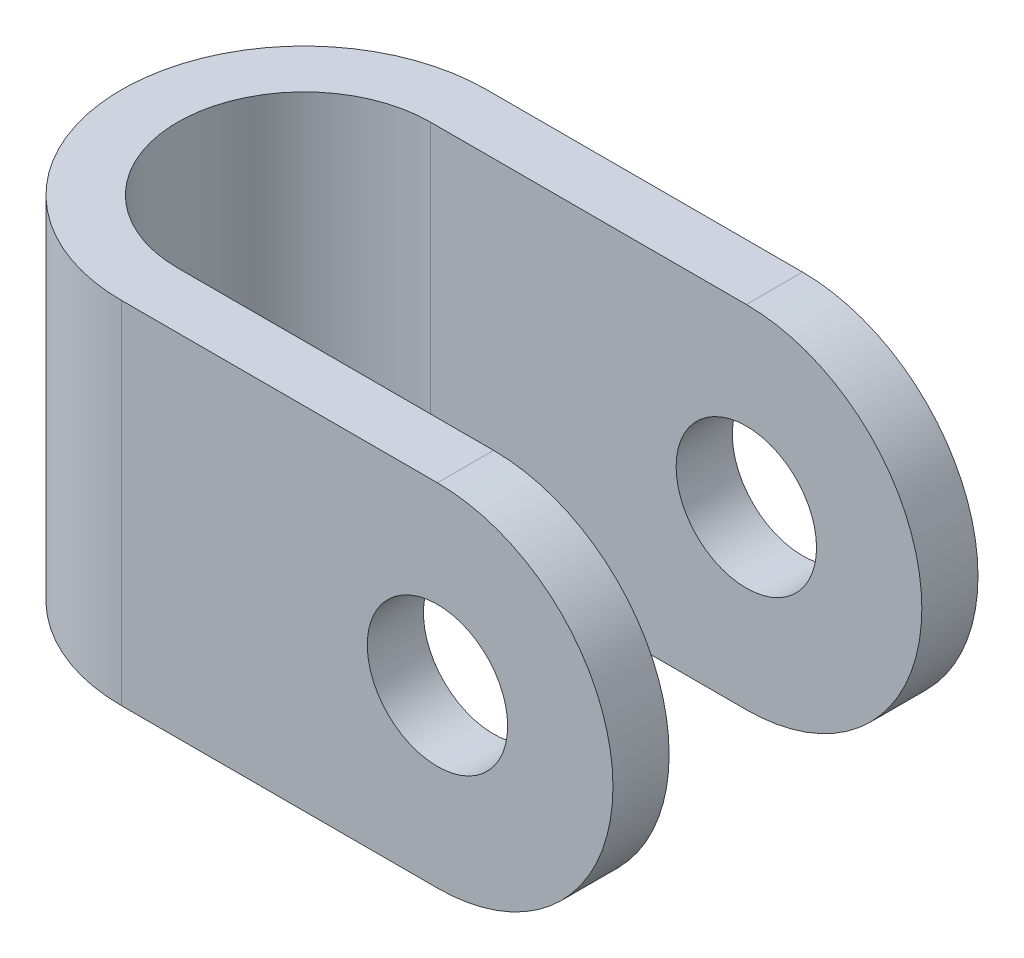
from build123d import *

# Parameters (mm, degrees)
BOSS_EXTRUDE1_DEPTH = 12.5
CUT_EXTRUDE1_DEPTH  = 46.356917885


with BuildPart() as part:
    # Sketch1 → Boss-Extrude1 (new, symmetric)
    with BuildSketch(Plane(origin=(0, 0, 0), x_dir=(1, 0, 0), z_dir=(0, 1, 0))):
        with BuildLine():
            Line((0, 13), (35, 13))
            Line((35, 13), (35, 9))
            Line((35, 9), (0, 9))
            ThreePointArc((0, 9), (-6.363961031, 6.363961031), (-9, 0))
            ThreePointArc((-9, 0), (-6.363961031, -6.363961031), (0, -9))
            Line((0, -9), (35, -9))
            Line((35, -9), (35, -13))
            Line((35, -13), (0, -13))
            ThreePointArc((0, -13), (-9.192388155, -9.192388155), (-13, 0))
            ThreePointArc((-13, 0), (-9.192388155, 9.192388155), (0, 13))
        make_face()
    extrude(amount=BOSS_EXTRUDE1_DEPTH, both=True)

    # Sketch2 → Cut-Extrude1 (cut, through all)
    with BuildSketch(Plane.XY.offset(13)):
        with BuildLine():
            ThreePointArc((27.5, 0), (22.5, 5), (17.5, 0))
            Line((17.5, 0), (27.5, 0))
        make_face()
        with BuildLine():
            Line((27.5, 0), (17.5, 0))
            ThreePointArc((17.5, 0), (22.5, -5), (27.5, 0))
        make_face()
        with BuildLine():
            ThreePointArc((22.5, 12.5), (31.338834755, 8.838834775), (35, 2.9e-08))
            Line((35, 2.9e-08), (35, 12.5))
            Line((35, 12.5), (22.5, 12.5))
        make_face()
        with BuildLine():
            Line((35, -12.5), (35, 2.9e-08))
            ThreePointArc((35, 2.9e-08), (31.338834775, -8.838834755), (22.5, -12.5))
            Line((22.5, -12.5), (35, -12.5))
        make_face()
    extrude(amount=-CUT_EXTRUDE1_DEPTH, mode=Mode.SUBTRACT)


solid = part.part
